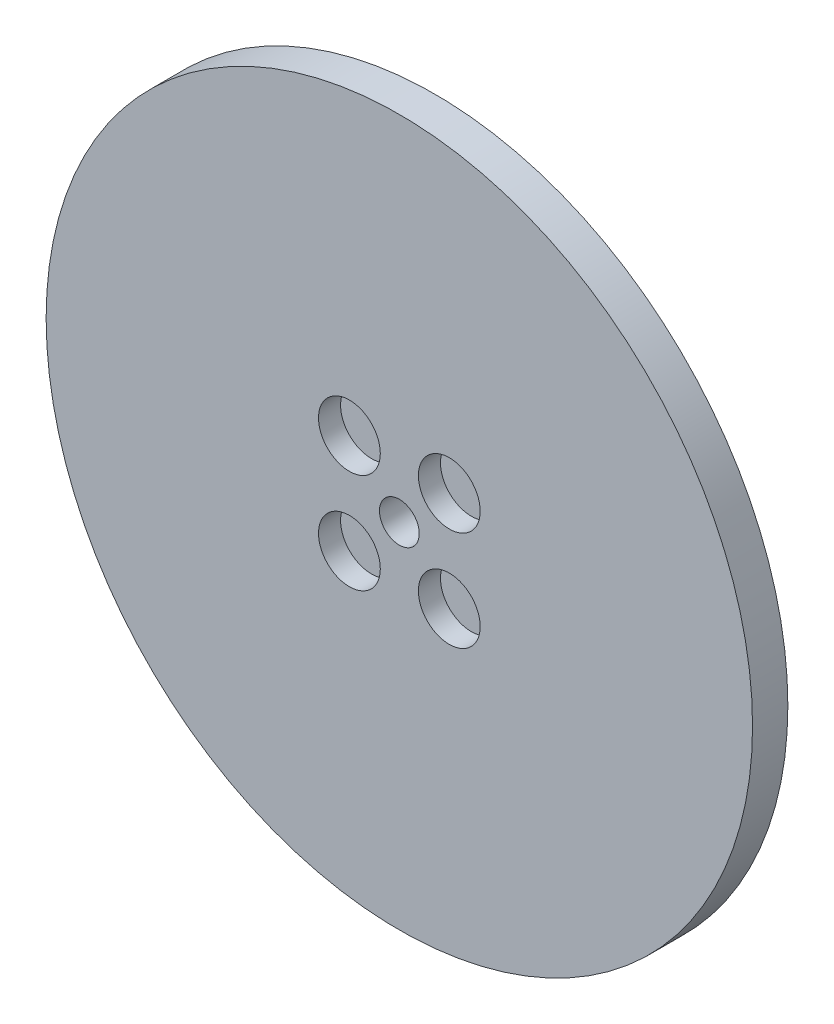
from build123d import *

# Parameters (mm, degrees)
SKETCH1_R           = 30
SKETCH1_R_2         = 12.5
BOSS_EXTRUDE1_DEPTH = 4
SKETCH2_R           = 40
SKETCH2_R_2         = 2.25
SKETCH2_R_3         = 1.5
BOSS_EXTRUDE2_DEPTH = 4
SKETCH3_R           = 3.5
CUT_EXTRUDE1_DEPTH  = 2.5
SKETCH4_R           = 5.15
CUT_EXTRUDE2_DEPTH  = 4
SKETCH5_R           = 3.5
BOSS_EXTRUDE3_DEPTH = 0.2


with BuildPart() as part:
    # Sketch1 → Boss-Extrude1 (new body)
    with BuildSketch(Plane.XY):
        Circle(SKETCH1_R)
        Circle(SKETCH1_R_2, mode=Mode.SUBTRACT)
    extrude(amount=BOSS_EXTRUDE1_DEPTH)

    # Sketch2 → Boss-Extrude2 (add)
    with BuildSketch(Plane.XY.offset(4)):
        Circle(SKETCH2_R)
        Circle(SKETCH2_R_2, mode=Mode.SUBTRACT)
        with Locations((-5.655999742, 5.657708628)):
            Circle(SKETCH2_R_3, mode=Mode.SUBTRACT)
        with Locations((-5.655999742, -5.657708628)):
            Circle(SKETCH2_R_3, mode=Mode.SUBTRACT)
        with Locations((5.655999742, -5.657708628)):
            Circle(SKETCH2_R_3, mode=Mode.SUBTRACT)
        with Locations((5.655999742, 5.657708628)):
            Circle(SKETCH2_R_3, mode=Mode.SUBTRACT)
    extrude(amount=BOSS_EXTRUDE2_DEPTH)

    # Sketch3 → Cut-Extrude1 (cut)
    with BuildSketch(Plane.XY.offset(8)):
        with Locations((-5.655999742, 5.657708628)):
            Circle(SKETCH3_R)
        with Locations((5.655999742, 5.657708628)):
            Circle(SKETCH3_R)
        with Locations((5.655999742, -5.657708628)):
            Circle(SKETCH3_R)
        with Locations((-5.655999742, -5.657708628)):
            Circle(SKETCH3_R)
    extrude(amount=-CUT_EXTRUDE1_DEPTH, mode=Mode.SUBTRACT)

    # Sketch4 → Cut-Extrude2 (cut)
    with BuildSketch(Plane(origin=(0, 0, 0), x_dir=(-1, 0, 0), z_dir=(0, 0, -1))):
        with Locations((-20, 0)):
            Circle(SKETCH4_R)
    extrude(amount=-CUT_EXTRUDE2_DEPTH, mode=Mode.SUBTRACT)

    # Sketch5 → Boss-Extrude3 (add)
    with BuildSketch(Plane.XY.offset(5.5)):
        with Locations((-5.655999742, 5.657708628)):
            Circle(SKETCH5_R)
        with Locations((5.655999742, 5.657708628)):
            Circle(SKETCH5_R)
        with Locations((-5.655999742, -5.657708628)):
            Circle(SKETCH5_R)
        with Locations((5.655999742, -5.657708628)):
            Circle(SKETCH5_R)
    extrude(amount=-BOSS_EXTRUDE3_DEPTH)


solid = part.part
